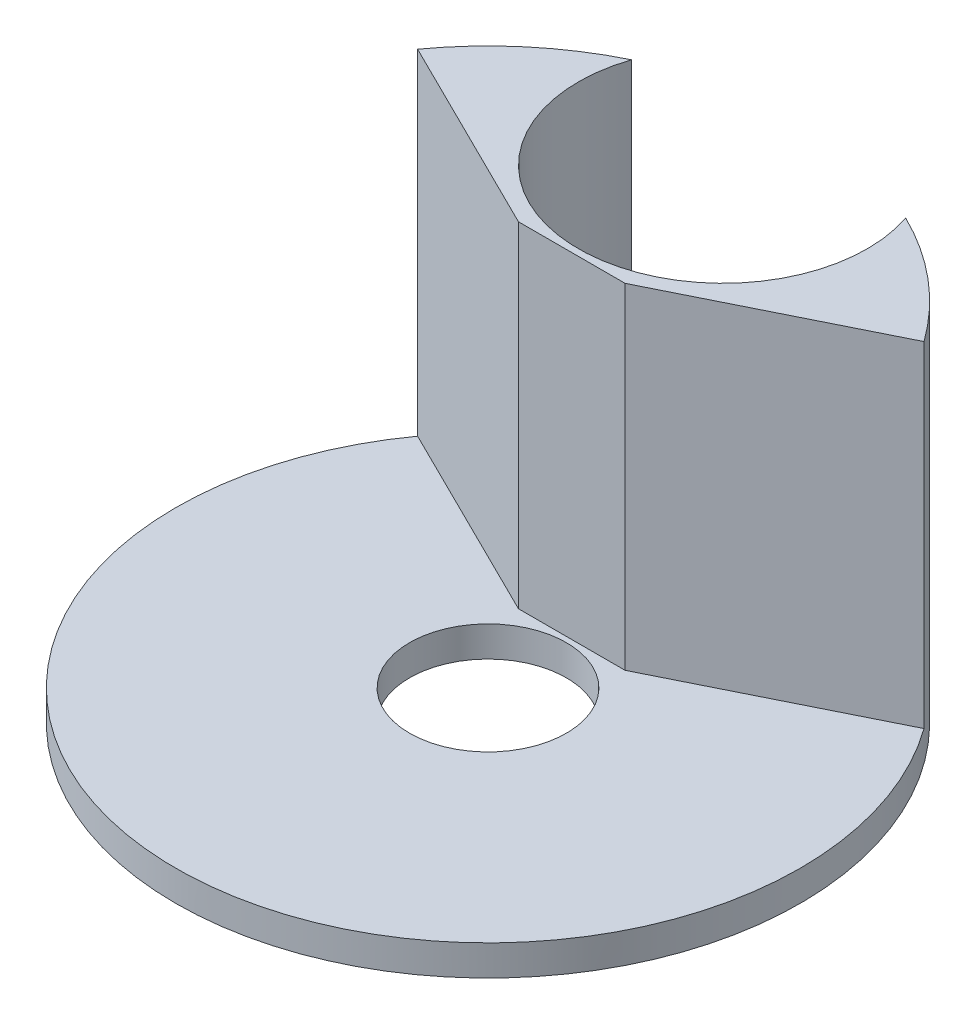
from build123d import *

# Parameters (mm, degrees)
SKETCH1_R           = 20.5
BOSS_EXTRUDE1_DEPTH = 2
SKETCH2_R           = 5.15
CUT_EXTRUDE1_DEPTH  = 3
SKETCH3_R           = 6.5
CUT_EXTRUDE2_DEPTH  = 2
BOSS_EXTRUDE4_DEPTH = 22


with BuildPart() as part:
    # Sketch1 → Boss-Extrude1 (new body)
    with BuildSketch(Plane(origin=(0, 0, 0), x_dir=(1, 0, 0), z_dir=(0, 1, 0))):
        with Locations(Location((0, 0, 0), (0, 0, 270))):
            Circle(SKETCH1_R)
    extrude(amount=BOSS_EXTRUDE1_DEPTH)

    # Sketch2 → Cut-Extrude1 (cut)
    with BuildSketch(Plane(origin=(0, 2, 0), x_dir=(1, 0, 0), z_dir=(0, 1, 0))):
        with Locations(Location((0, 0, 0), (0, 0, 270))):
            Circle(SKETCH2_R)
    extrude(amount=-CUT_EXTRUDE1_DEPTH, mode=Mode.SUBTRACT)

    # Sketch3 → Cut-Extrude2 (cut)
    with BuildSketch(Plane(origin=(0, 2, 0), x_dir=(1, 0, 0), z_dir=(0, 1, 0))):
        with Locations(Location((0, 13, 0), (0, 0, 270))):
            Circle(SKETCH3_R)
    extrude(amount=-CUT_EXTRUDE2_DEPTH, mode=Mode.SUBTRACT)

    # Sketch4 → Boss-Extrude4 (add)
    with BuildSketch(Plane(origin=(0, 2, 0), x_dir=(1, 0, 0), z_dir=(0, 1, 0))):
        with BuildLine():
            Line((-16.620770139, 12), (-3.5, 5.5))
            Line((-3.5, 5.5), (3.5, 5.5))
            Line((3.5, 5.5), (16.620770139, 12))
            ThreePointArc((16.620770139, 12), (13.206287248, 15.679412525), (9, 18.418740456))
            ThreePointArc((9, 18.418740456), (0, 5.93152382), (-9, 18.418740456))
            ThreePointArc((-9, 18.418740456), (-13.206287248, 15.679412525), (-16.620770139, 12))
        make_face()
    extrude(amount=BOSS_EXTRUDE4_DEPTH)


solid = part.part
